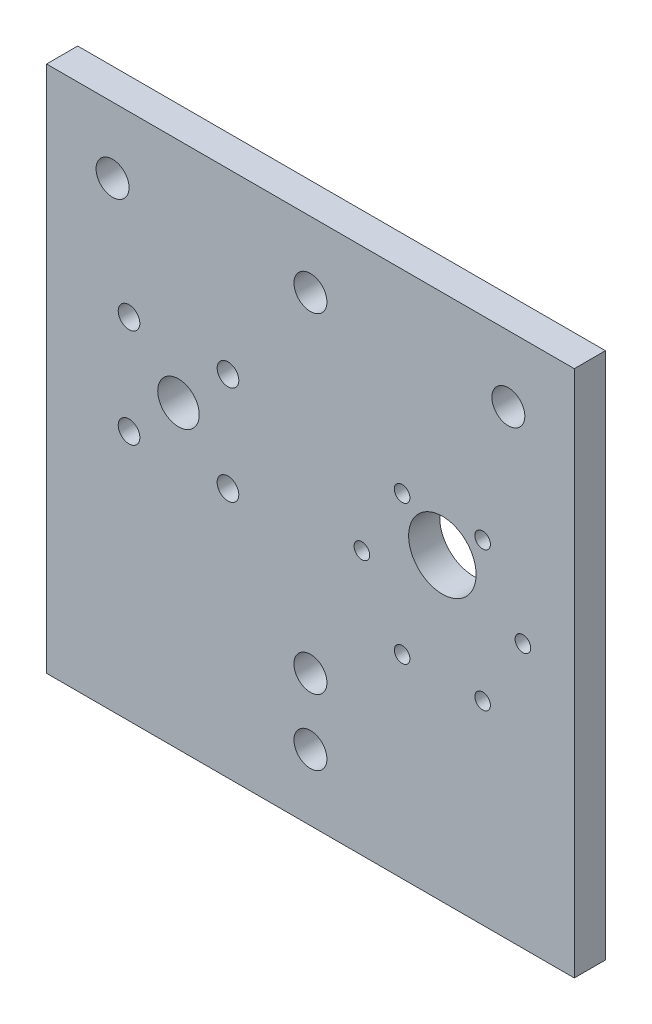
from build123d import *

# Parameters (mm, degrees)
SKETCH1_W           = 101.6
SKETCH1_H           = 101.6
SKETCH1_R           = 6.5
SKETCH1_R_2         = 1.5
SKETCH1_R_3         = 3.175
SKETCH1_R_4         = 4
SKETCH1_R_5         = 2.0828
BOSS_EXTRUDE1_DEPTH = 5.9944


with BuildPart() as part:
    # Sketch1 → Boss-Extrude1 (new body)
    with BuildSketch(Plane.XY):
        with Locations((50.8, 50.8)):
            Rectangle(SKETCH1_W, SKETCH1_H)
        with Locations(Location((76.2, 57.8, 0), (0, 0, 180))):
            Circle(SKETCH1_R, mode=Mode.SUBTRACT)
        with Locations(Location((60.7, 50.8, 0), (0, 0, 180))):
            Circle(SKETCH1_R_2, mode=Mode.SUBTRACT)
        with Locations(Location((91.7, 50.8, 0), (0, 0, 180))):
            Circle(SKETCH1_R_2, mode=Mode.SUBTRACT)
        with Locations(Location((83.95, 37.376606241, 0), (0, 0, 180))):
            Circle(SKETCH1_R_2, mode=Mode.SUBTRACT)
        with Locations(Location((68.45, 37.376606241, 0), (0, 0, 180))):
            Circle(SKETCH1_R_2, mode=Mode.SUBTRACT)
        with Locations(Location((68.45, 64.223393759, 0), (0, 0, 180))):
            Circle(SKETCH1_R_2, mode=Mode.SUBTRACT)
        with Locations(Location((83.95, 64.223393759, 0), (0, 0, 180))):
            Circle(SKETCH1_R_2, mode=Mode.SUBTRACT)
        with Locations(Location((12.7, 88.9, 0), (0, 0, 180))):
            Circle(SKETCH1_R_3, mode=Mode.SUBTRACT)
        with Locations(Location((88.9, 88.9, 0), (0, 0, 180))):
            Circle(SKETCH1_R_3, mode=Mode.SUBTRACT)
        with Locations(Location((25.4, 57.8, 0), (0, 0, 180))):
            Circle(SKETCH1_R_4, mode=Mode.SUBTRACT)
        with Locations(Location((15.875, 67.325, 0), (0, 0, 180))):
            Circle(SKETCH1_R_5, mode=Mode.SUBTRACT)
        with Locations(Location((34.925, 67.325, 0), (0, 0, 180))):
            Circle(SKETCH1_R_5, mode=Mode.SUBTRACT)
        with Locations(Location((34.925, 48.275, 0), (0, 0, 180))):
            Circle(SKETCH1_R_5, mode=Mode.SUBTRACT)
        with Locations(Location((15.875, 48.275, 0), (0, 0, 180))):
            Circle(SKETCH1_R_5, mode=Mode.SUBTRACT)
        with Locations(Location((50.8, 88.9, 0), (0, 0, 180))):
            Circle(SKETCH1_R_3, mode=Mode.SUBTRACT)
        with Locations(Location((50.8, 25.4, 0), (0, 0, 180))):
            Circle(SKETCH1_R_3, mode=Mode.SUBTRACT)
        with Locations(Location((50.8, 12.7, 0), (0, 0, 180))):
            Circle(SKETCH1_R_3, mode=Mode.SUBTRACT)
    extrude(amount=BOSS_EXTRUDE1_DEPTH)


solid = part.part
